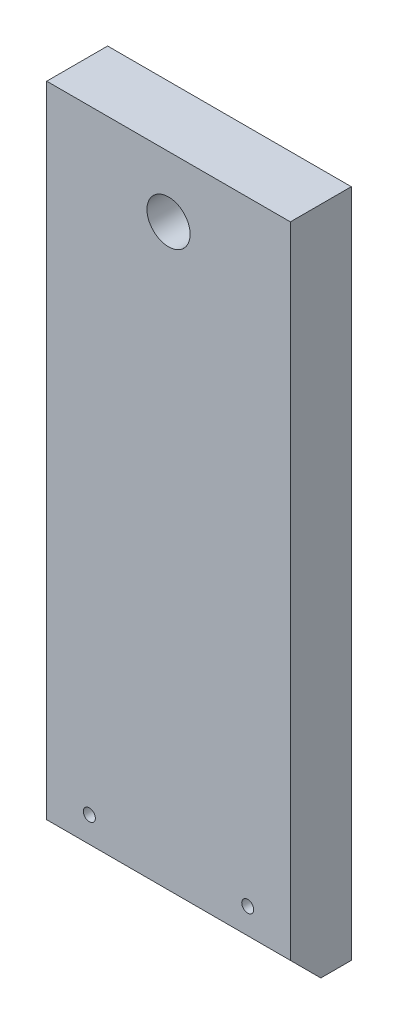
from build123d import *

# Parameters (mm, degrees)
SKETCH1_W           = 25.4
SKETCH1_H           = 69.85
BOSS_EXTRUDE1_DEPTH = 6.35
SKETCH2_R           = 2.25
SKETCH2_R_2         = 0.625
CUT_EXTRUDE1_DEPTH  = 6.35
CHAMFER1_SIZE       = 3.175


with BuildPart() as part:
    # Sketch1 → Boss-Extrude1 (new body)
    with BuildSketch(Plane.XY):
        with Locations((12.7, 34.925)):
            Rectangle(SKETCH1_W, SKETCH1_H)
    extrude(amount=BOSS_EXTRUDE1_DEPTH)

    # Sketch2 → Cut-Extrude1 (cut)
    with BuildSketch(Plane.XY.offset(6.35)):
        with Locations((12.7, 63.5)):
            Circle(SKETCH2_R)
        with Locations((4.445, 5.842)):
            Circle(SKETCH2_R_2)
        with Locations((20.955, 5.842)):
            Circle(SKETCH2_R_2)
    extrude(amount=-CUT_EXTRUDE1_DEPTH, mode=Mode.SUBTRACT)

    # Chamfer1
    chamfer1_edges = [part.edges().sort_by_distance(p)[0] for p in [
        (12.7, 0, 6.35),
    ]]
    chamfer(chamfer1_edges, length=CHAMFER1_SIZE)


solid = part.part
